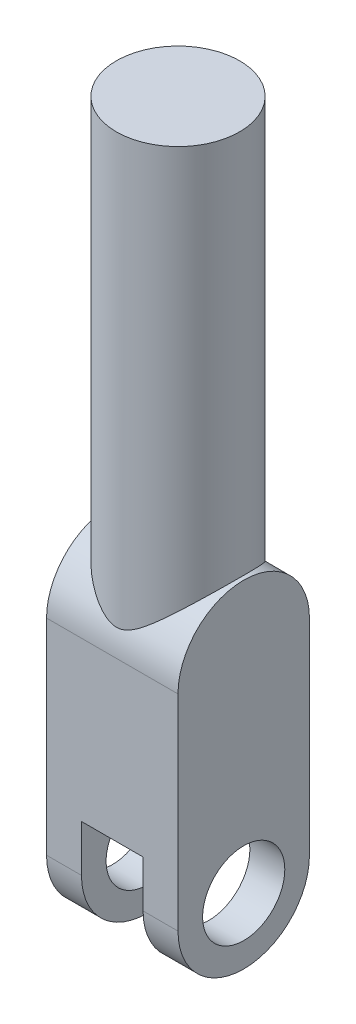
from build123d import *

# Parameters (mm, degrees)
SKETCH_19_W         = 15
SKETCH_19_H         = 110
EXTRUDE_11_DEPTH    = 16
SKETCH_23_R         = 19.628880498
CUT_EXTRUDE_4_DEPTH = 7.5
SKETCH_24_R         = 10
CUT_EXTRUDE_5_DEPTH = 27.5


with BuildPart() as part:
    # 草图19 → 旋转1 (revolve)
    with BuildSketch(Plane(origin=(0, 0, 0), x_dir=(0, 0, -1), z_dir=(1, 0, 0))):
        with Locations((-7.5, -55)):
            Rectangle(SKETCH_19_W, SKETCH_19_H)
    revolve(axis=Axis((0, 0, 0), (0, -1, 0)))

    # 草图22 → 凸台-拉伸11 (add, symmetric)
    with BuildSketch(Plane(origin=(0, 0, 0), x_dir=(0, 0, -1), z_dir=(1, 0, 0))):
        with BuildLine():
            Line((16, -110), (16, -160))
            ThreePointArc((16, -160), (0, -176), (-16, -160))
            Line((-16, -160), (-16, -110))
            ThreePointArc((-16, -110), (0, -94), (16, -110))
        make_face()
    extrude(amount=EXTRUDE_11_DEPTH, both=True)

    # 草图23 → 切除-拉伸4 (cut, symmetric)
    with BuildSketch(Plane(origin=(0, 0, 0), x_dir=(0, 0, -1), z_dir=(1, 0, 0))):
        with Locations((0, -160)):
            Circle(SKETCH_23_R)
    extrude(amount=CUT_EXTRUDE_4_DEPTH, both=True, mode=Mode.SUBTRACT)

    # 草图24 → 切除-拉伸5 (cut, symmetric)
    with BuildSketch(Plane(origin=(0, 0, 0), x_dir=(0, 0, -1), z_dir=(1, 0, 0))):
        with Locations((0, -160)):
            Circle(SKETCH_24_R)
    extrude(amount=CUT_EXTRUDE_5_DEPTH, both=True, mode=Mode.SUBTRACT)


solid = part.part
